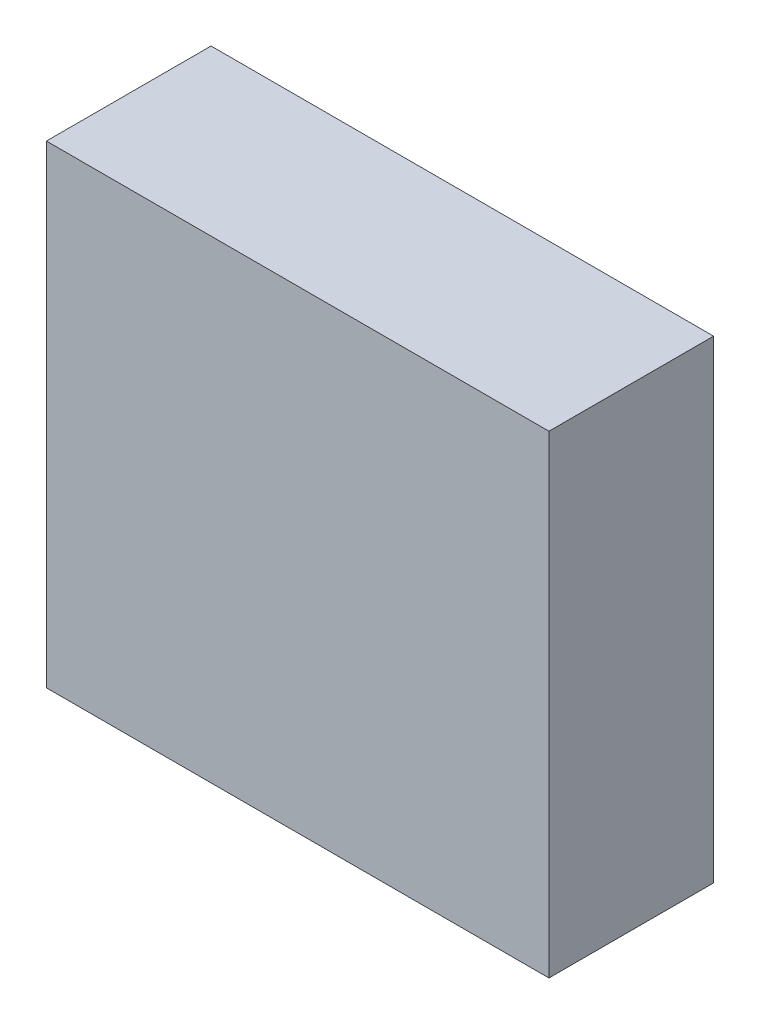
from build123d import *

# Parameters (mm, degrees)
SKETCH1_W               = 3.0524
SKETCH1_H               = 2.8762
COMPONENT_OUTLINE_DEPTH = 1


with BuildPart() as part:
    # Sketch1 → Component_Outline (new body)
    with BuildSketch(Plane.XY):
        with Locations((0, 0.0381)):
            Rectangle(SKETCH1_W, SKETCH1_H)
    extrude(amount=COMPONENT_OUTLINE_DEPTH)


solid = part.part
